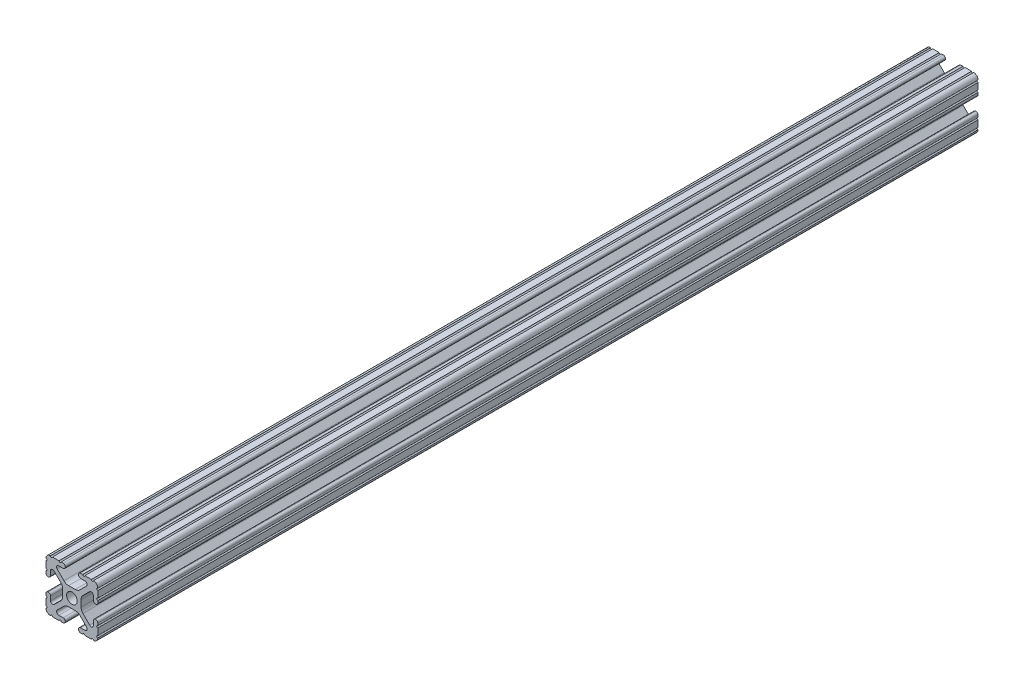
from build123d import *

# Parameters (mm, degrees)
SKETCH1_R           = 2.6035
BOSS_EXTRUDE1_DEPTH = 215.9


with BuildPart() as part:
    # Sketch1 → Boss-Extrude1 (new, symmetric)
    with BuildSketch(Plane.XY):
        with BuildLine():
            Line((-7.179650497, -8.645192506), (-3.952270251, -5.423690499))
            ThreePointArc((-3.952270251, -5.423690499), (-2.922936451, -4.736929036), (-1.709253557, -4.4958))
            Line((-1.709253557, -4.4958), (1.709253557, -4.4958))
            ThreePointArc((1.709253557, -4.4958), (2.922936451, -4.736929036), (3.952270251, -5.423690499))
            Line((3.952270251, -5.423690499), (7.179650497, -8.645192506))
            ThreePointArc((7.179650497, -8.645192506), (7.41473083, -9.822813117), (6.416408329, -10.4902))
            Line((6.416408329, -10.4902), (4.287512407, -10.4902))
            ThreePointArc((4.287512407, -10.4902), (3.54574862, -10.79744862), (3.2385, -11.539212407))
            Line((3.2385, -11.539212407), (3.2385, -11.650987593))
            ThreePointArc((3.2385, -11.650987593), (3.54574862, -12.39275138), (4.287512407, -12.7))
            Line((4.287512407, -12.7), (5.317126718, -12.7))
            ThreePointArc((5.317126718, -12.7), (5.825126718, -12.192), (6.333126718, -12.7))
            Line((6.333126718, -12.7), (9.550443118, -12.7))
            ThreePointArc((9.550443118, -12.7), (10.058366869, -12.192000006), (10.566443095, -12.699847501))
            ThreePointArc((10.566443095, -12.699847501), (12.082537762, -12.08250727), (12.699846982, -10.566399977))
            ThreePointArc((12.699846982, -10.566399977), (12.192000006, -10.058323491), (12.7, -9.5504))
            Line((12.7, -9.5504), (12.7, -6.3330836))
            ThreePointArc((12.7, -6.3330836), (12.192, -5.8250836), (12.7, -5.3170836))
            Line((12.7, -5.3170836), (12.7, -4.287469289))
            ThreePointArc((12.7, -4.287469289), (12.39275138, -3.545705502), (11.650987593, -3.238456882))
            Line((11.650987593, -3.238456882), (11.539212407, -3.238456882))
            ThreePointArc((11.539212407, -3.238456882), (10.79744862, -3.545705502), (10.4902, -4.287469289))
            Line((10.4902, -4.287469289), (10.4902, -6.402089023))
            ThreePointArc((10.4902, -6.402089023), (9.856505071, -7.351067942), (8.737131347, -7.129408934))
            Line((8.737131347, -7.129408934), (5.441005833, -3.840816462))
            ThreePointArc((5.441005833, -3.840816462), (4.750877967, -2.809883091), (4.5085, -1.593185507))
            Line((4.5085, -1.593185507), (4.5085, 1.593185507))
            ThreePointArc((4.5085, 1.593185507), (4.750877967, 2.809883091), (5.441005833, 3.840816462))
            Line((5.441005833, 3.840816462), (8.737131347, 7.129408934))
            ThreePointArc((8.737131347, 7.129408934), (9.856505071, 7.351067942), (10.4902, 6.402089023))
            Line((10.4902, 6.402089023), (10.4902, 4.287469289))
            ThreePointArc((10.4902, 4.287469289), (10.79744862, 3.545705502), (11.539212407, 3.238456882))
            Line((11.539212407, 3.238456882), (11.650987593, 3.238456882))
            ThreePointArc((11.650987593, 3.238456882), (12.39275138, 3.545705502), (12.7, 4.287469289))
            Line((12.7, 4.287469289), (12.7, 5.3170836))
            ThreePointArc((12.7, 5.3170836), (12.192, 5.8250836), (12.7, 6.3330836))
            Line((12.7, 6.3330836), (12.7, 9.5504))
            ThreePointArc((12.7, 9.5504), (12.192000006, 10.058323491), (12.699846982, 10.566399977))
            ThreePointArc((12.699846982, 10.566399977), (12.082537762, 12.08250727), (10.566443095, 12.699847501))
            ThreePointArc((10.566443095, 12.699847501), (10.058366869, 12.192000006), (9.550443118, 12.7))
            Line((9.550443118, 12.7), (6.333126718, 12.7))
            ThreePointArc((6.333126718, 12.7), (5.825126718, 12.192), (5.317126718, 12.7))
            Line((5.317126718, 12.7), (4.287512407, 12.7))
            ThreePointArc((4.287512407, 12.7), (3.54574862, 12.39275138), (3.2385, 11.650987593))
            Line((3.2385, 11.650987593), (3.2385, 11.539212407))
            ThreePointArc((3.2385, 11.539212407), (3.54574862, 10.79744862), (4.287512407, 10.4902))
            Line((4.287512407, 10.4902), (6.476788598, 10.4902))
            ThreePointArc((6.476788598, 10.4902), (7.432222385, 9.85140422), (7.207036008, 8.724370562))
            Line((7.207036008, 8.724370562), (3.898272566, 5.423169045))
            ThreePointArc((3.898272566, 5.423169045), (2.869120213, 4.736787962), (1.655778399, 4.4958))
            Line((1.655778399, 4.4958), (-1.655778399, 4.4958))
            ThreePointArc((-1.655778399, 4.4958), (-2.869120213, 4.736787962), (-3.898272566, 5.423169045))
            Line((-3.898272566, 5.423169045), (-7.207036008, 8.724370562))
            ThreePointArc((-7.207036008, 8.724370562), (-7.432222385, 9.85140422), (-6.476788598, 10.4902))
            Line((-6.476788598, 10.4902), (-4.287512407, 10.4902))
            ThreePointArc((-4.287512407, 10.4902), (-3.54574862, 10.79744862), (-3.2385, 11.539212407))
            Line((-3.2385, 11.539212407), (-3.2385, 11.650987593))
            ThreePointArc((-3.2385, 11.650987593), (-3.54574862, 12.39275138), (-4.287512407, 12.7))
            Line((-4.287512407, 12.7), (-5.317126718, 12.7))
            ThreePointArc((-5.317126718, 12.7), (-5.825126718, 12.192), (-6.333126718, 12.7))
            Line((-6.333126718, 12.7), (-9.550443118, 12.7))
            ThreePointArc((-9.550443118, 12.7), (-10.058366869, 12.192000006), (-10.566443095, 12.699847501))
            ThreePointArc((-10.566443095, 12.699847501), (-12.082537762, 12.08250727), (-12.699846982, 10.566399977))
            ThreePointArc((-12.699846982, 10.566399977), (-12.192000006, 10.058323491), (-12.7, 9.5504))
            Line((-12.7, 9.5504), (-12.7, 6.3330836))
            ThreePointArc((-12.7, 6.3330836), (-12.192, 5.8250836), (-12.7, 5.3170836))
            Line((-12.7, 5.3170836), (-12.7, 4.287469289))
            ThreePointArc((-12.7, 4.287469289), (-12.39275138, 3.545705502), (-11.650987593, 3.238456882))
            Line((-11.650987593, 3.238456882), (-11.539212407, 3.238456882))
            ThreePointArc((-11.539212407, 3.238456882), (-10.79744862, 3.545705502), (-10.4902, 4.287469289))
            Line((-10.4902, 4.287469289), (-10.4902, 6.402089023))
            ThreePointArc((-10.4902, 6.402089023), (-9.856505071, 7.351067942), (-8.737131347, 7.129408934))
            Line((-8.737131347, 7.129408934), (-5.441005833, 3.840816462))
            ThreePointArc((-5.441005833, 3.840816462), (-4.750877967, 2.809883091), (-4.5085, 1.593185507))
            Line((-4.5085, 1.593185507), (-4.5085, -1.593185507))
            ThreePointArc((-4.5085, -1.593185507), (-4.750877967, -2.809883091), (-5.441005833, -3.840816462))
            Line((-5.441005833, -3.840816462), (-8.737131347, -7.129408934))
            ThreePointArc((-8.737131347, -7.129408934), (-9.856505071, -7.351067942), (-10.4902, -6.402089023))
            Line((-10.4902, -6.402089023), (-10.4902, -4.287469289))
            ThreePointArc((-10.4902, -4.287469289), (-10.79744862, -3.545705502), (-11.539212407, -3.238456882))
            Line((-11.539212407, -3.238456882), (-11.650987593, -3.238456882))
            ThreePointArc((-11.650987593, -3.238456882), (-12.39275138, -3.545705502), (-12.7, -4.287469289))
            Line((-12.7, -4.287469289), (-12.7, -5.3170836))
            ThreePointArc((-12.7, -5.3170836), (-12.192, -5.8250836), (-12.7, -6.3330836))
            Line((-12.7, -6.3330836), (-12.7, -9.5504))
            ThreePointArc((-12.7, -9.5504), (-12.192000006, -10.058323491), (-12.699846982, -10.566399977))
            ThreePointArc((-12.699846982, -10.566399977), (-12.082537762, -12.08250727), (-10.566443095, -12.699847501))
            ThreePointArc((-10.566443095, -12.699847501), (-10.058366869, -12.192000006), (-9.550443118, -12.7))
            Line((-9.550443118, -12.7), (-6.333126718, -12.7))
            ThreePointArc((-6.333126718, -12.7), (-5.825126718, -12.192), (-5.317126718, -12.7))
            Line((-5.317126718, -12.7), (-4.287512407, -12.7))
            ThreePointArc((-4.287512407, -12.7), (-3.54574862, -12.39275138), (-3.2385, -11.650987593))
            Line((-3.2385, -11.650987593), (-3.2385, -11.539212407))
            ThreePointArc((-3.2385, -11.539212407), (-3.54574862, -10.79744862), (-4.287512407, -10.4902))
            Line((-4.287512407, -10.4902), (-6.416408329, -10.4902))
            ThreePointArc((-6.416408329, -10.4902), (-7.41473083, -9.822813117), (-7.179650497, -8.645192506))
        make_face()
        Circle(SKETCH1_R, mode=Mode.SUBTRACT)
    extrude(amount=BOSS_EXTRUDE1_DEPTH, both=True)


solid = part.part
